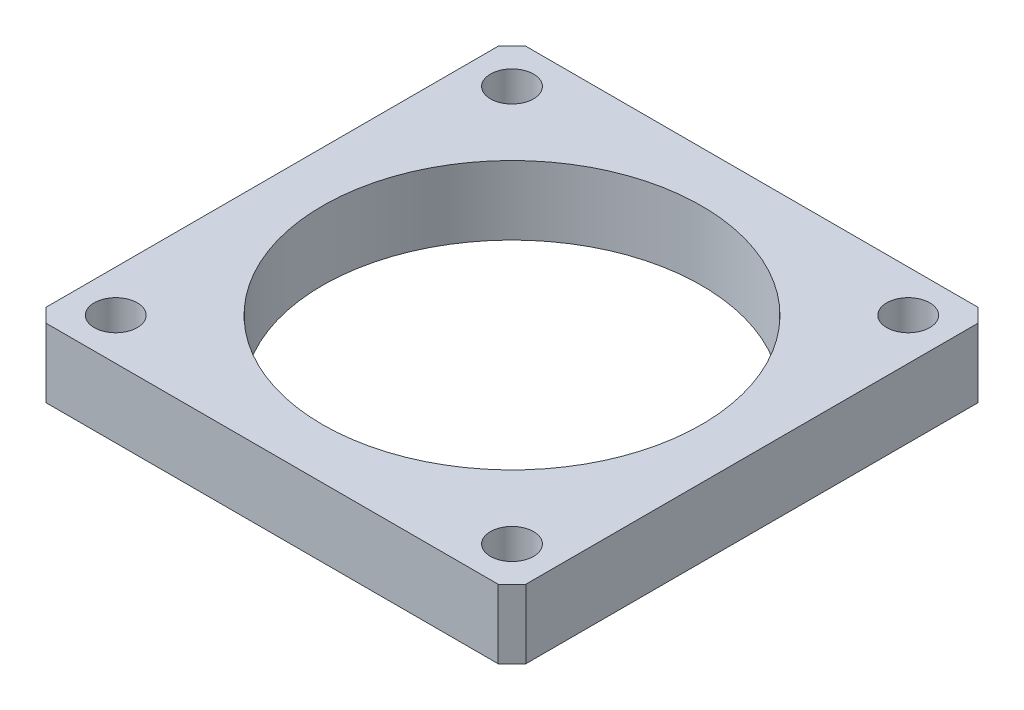
from build123d import *

# Parameters (mm, degrees)
SKETCH_2_W      = 27.85
SKETCH_2_H      = 27.85
SKETCH_2_R      = 1.25
SKETCH_2_R_2    = 11
EXTRUDE_1_DEPTH = 4
CHAMFER_1_SIZE  = 0.8


with BuildPart() as part:
    # Эскиз2 → Бобышка-Вытянуть1 (new body)
    with BuildSketch(Plane(origin=(0, 0, 0), x_dir=(1, 0, 0), z_dir=(0, 1, 0))):
        Rectangle(SKETCH_2_W, SKETCH_2_H)
        with Locations(Location((-11.5, 11.5, 0), (0, 0, 270))):
            Circle(SKETCH_2_R, mode=Mode.SUBTRACT)
        with Locations(Location((-11.5, -11.5, 0), (0, 0, 270))):
            Circle(SKETCH_2_R, mode=Mode.SUBTRACT)
        with Locations(Location((11.5, -11.5, 0), (0, 0, 270))):
            Circle(SKETCH_2_R, mode=Mode.SUBTRACT)
        with Locations(Location((11.5, 11.5, 0), (0, 0, 270))):
            Circle(SKETCH_2_R, mode=Mode.SUBTRACT)
        with Locations(Location((0, 0, 0), (0, 0, 270))):
            Circle(SKETCH_2_R_2, mode=Mode.SUBTRACT)
    extrude(amount=EXTRUDE_1_DEPTH)

    # Фаска1
    chamfer_1_edges = [part.edges().sort_by_distance(p)[0] for p in [
        (13.925, 2, -13.925),
        (13.925, 2, 13.925),
        (-13.925, 2, 13.925),
        (-13.925, 2, -13.925),
    ]]
    chamfer(chamfer_1_edges, length=CHAMFER_1_SIZE)


solid = part.part
